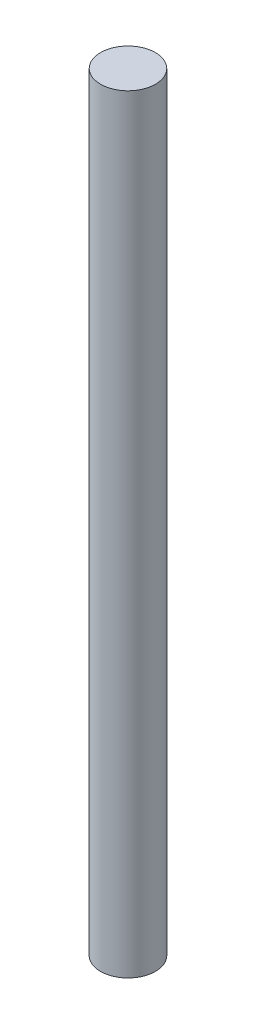
from build123d import *

# Parameters (mm, degrees)
SKETCH1_R           = 0.5
BOSS_EXTRUDE1_DEPTH = 14


with BuildPart() as part:
    # Sketch1 → Boss-Extrude1 (new body)
    with BuildSketch(Plane(origin=(0, 0, 0), x_dir=(1, 0, 0), z_dir=(0, 1, 0))):
        with Locations(Location((0, 0, 0), (0, 0, 270))):
            Circle(SKETCH1_R)
    extrude(amount=BOSS_EXTRUDE1_DEPTH)


solid = part.part
